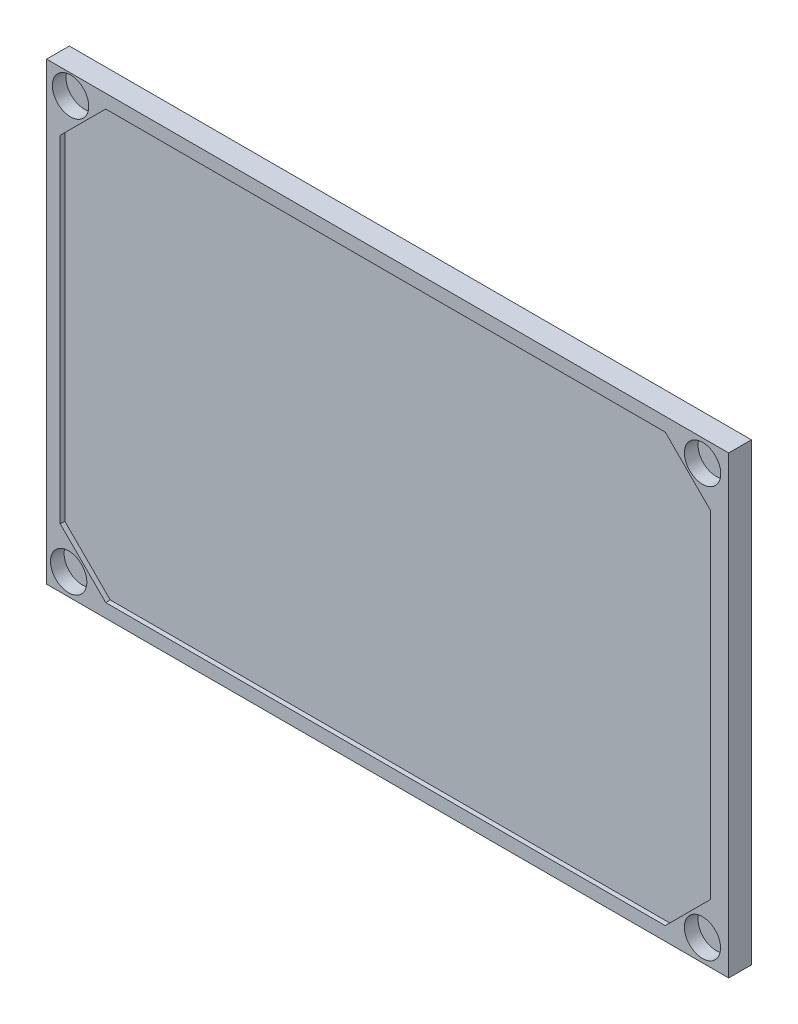
from build123d import *

# Parameters (mm, degrees)
ESQUISSE1_W              = 150
ESQUISSE1_H              = 100
BOSS_EXTRU_1_DEPTH       = 5
ENL_V_MAT_EXTRU_1_DEPTH  = 1
ESQUISSE3_R              = 4
ENL_V_MAT_EXTRU_2_DEPTH  = 3
ESQUISSE6_R              = 4
ENL_V_MAT_EXTRU_6_DEPTH  = 3
ESQUISSE7_R              = 4
ENL_V_MAT_EXTRU_8_DEPTH  = 3
ESQUISSE8_R              = 3.982204299
ENL_V_MAT_EXTRU_10_DEPTH = 3


with BuildPart() as part:
    # Esquisse1 → Boss.-Extru.1 (new body)
    with BuildSketch(Plane.XY):
        with Locations((-21.17373101, -10.772659733)):
            Rectangle(ESQUISSE1_W, ESQUISSE1_H)
    extrude(amount=BOSS_EXTRU_1_DEPTH)

    # Esquisse2 → Enlèv. mat.-Extru.1 (cut)
    with BuildSketch(Plane.XY.offset(5)):
        Polygon((-83.17373101, 36.227340267), (39.87366547, 36.227340267), (49.87366547, 26.227340267), (49.87366547, -47.772659733), (39.87366547, -57.772659733), (-83.17373101, -57.772659733), (-93.17373101, -47.772659733), (-93.17373101, 26.227340267), align=None)
    extrude(amount=-ENL_V_MAT_EXTRU_1_DEPTH, mode=Mode.SUBTRACT)

    # Esquisse3 → Enlèv. mat.-Extru.2 (cut)
    with BuildSketch(Plane.XY.offset(5)):
        with Locations((-90.907387201, 34.857641034)):
            Circle(ESQUISSE3_R)
    extrude(amount=-ENL_V_MAT_EXTRU_2_DEPTH, mode=Mode.SUBTRACT)

    # Esquisse6 → Enlèv. mat.-Extru.6 (cut)
    with BuildSketch(Plane.XY.offset(5)):
        with Locations((48.083277729, 34.38144698)):
            Circle(ESQUISSE6_R)
    extrude(amount=-ENL_V_MAT_EXTRU_6_DEPTH, mode=Mode.SUBTRACT)

    # Esquisse7 → Enlèv. mat.-Extru.8 (cut)
    with BuildSketch(Plane.XY.offset(5)):
        with Locations((-91.323021124, -55.986982745)):
            Circle(ESQUISSE7_R)
    extrude(amount=-ENL_V_MAT_EXTRU_8_DEPTH, mode=Mode.SUBTRACT)

    # Esquisse8 → Enlèv. mat.-Extru.10 (cut)
    with BuildSketch(Plane.XY.offset(5)):
        with Locations((48.063086484, -55.947185674)):
            Circle(ESQUISSE8_R)
    extrude(amount=-ENL_V_MAT_EXTRU_10_DEPTH, mode=Mode.SUBTRACT)


solid = part.part
